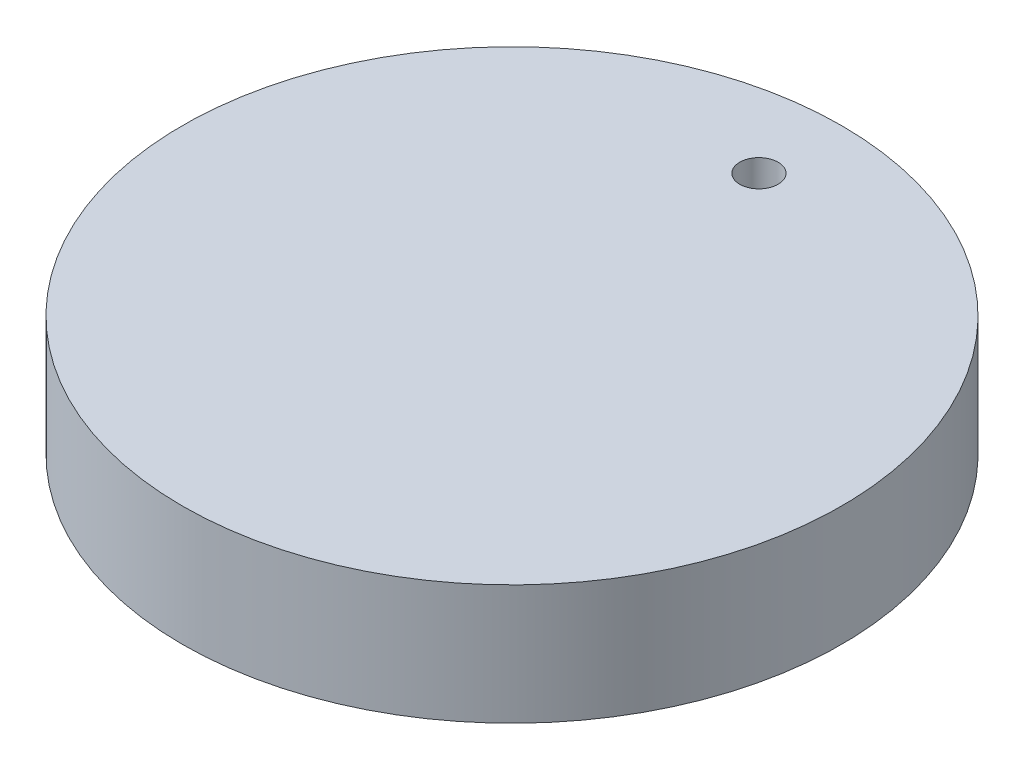
from build123d import *

# Parameters (mm, degrees)
SKETCH1_R           = 55
SKETCH1_R_2         = 3.2
BOSS_EXTRUDE1_DEPTH = 20


with BuildPart() as part:
    # Sketch1 → Boss-Extrude1 (new body)
    with BuildSketch(Plane(origin=(0, 0, 0), x_dir=(1, 0, 0), z_dir=(0, 1, 0))):
        with Locations(Location((0, 0, 0), (0, 0, 270))):
            Circle(SKETCH1_R)
        with Locations(Location((0, 41.210838503, 0), (0, 0, 270))):
            Circle(SKETCH1_R_2, mode=Mode.SUBTRACT)
    extrude(amount=BOSS_EXTRUDE1_DEPTH)


solid = part.part
